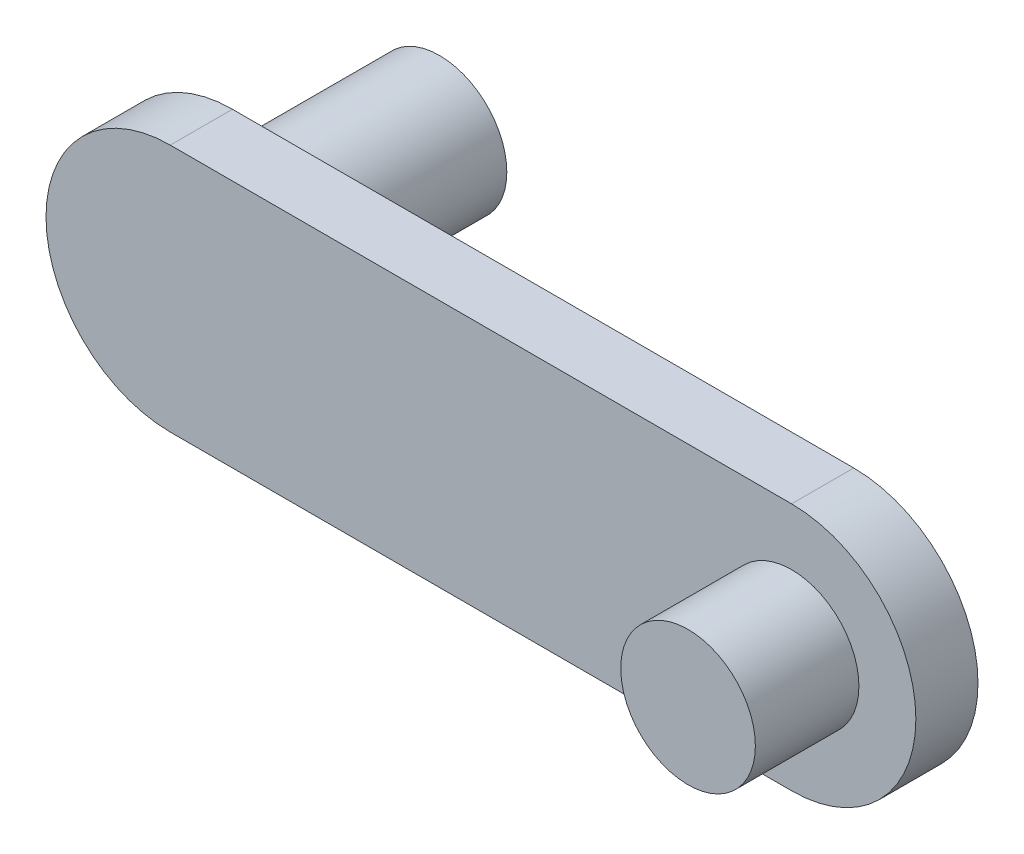
from build123d import *

# Parameters (mm, degrees)
Y_KSEKLIK_EKSTR_ZYON1_DEPTH = 3
IZIM2_R                     = 3.25
Y_KSEKLIK_EKSTR_ZYON2_DEPTH = 5
IZIM3_R                     = 3.25
Y_KSEKLIK_EKSTR_ZYON3_DEPTH = 10


with BuildPart() as part:
    # Çizim1 → Yükseklik-Ekstrüzyon1 (new body)
    with BuildSketch(Plane.XY):
        with BuildLine():
            Line((-15, 6), (15, 6))
            ThreePointArc((15, 6), (21, 0), (15, -6))
            Line((15, -6), (-15, -6))
            ThreePointArc((-15, -6), (-21, 0), (-15, 6))
        make_face()
    extrude(amount=Y_KSEKLIK_EKSTR_ZYON1_DEPTH)

    # Çizim2 → Yükseklik-Ekstrüzyon2 (add)
    with BuildSketch(Plane.XY.offset(3)):
        with Locations((15, 0)):
            Circle(IZIM2_R)
    extrude(amount=Y_KSEKLIK_EKSTR_ZYON2_DEPTH)

    # Çizim3 → Yükseklik-Ekstrüzyon3 (add)
    with BuildSketch(Plane(origin=(0, 0, 0), x_dir=(-1, 0, 0), z_dir=(0, 0, -1))):
        with Locations(Location((15, 0, 0), (0, 0, 180))):
            Circle(IZIM3_R)
    extrude(amount=Y_KSEKLIK_EKSTR_ZYON3_DEPTH)


solid = part.part
